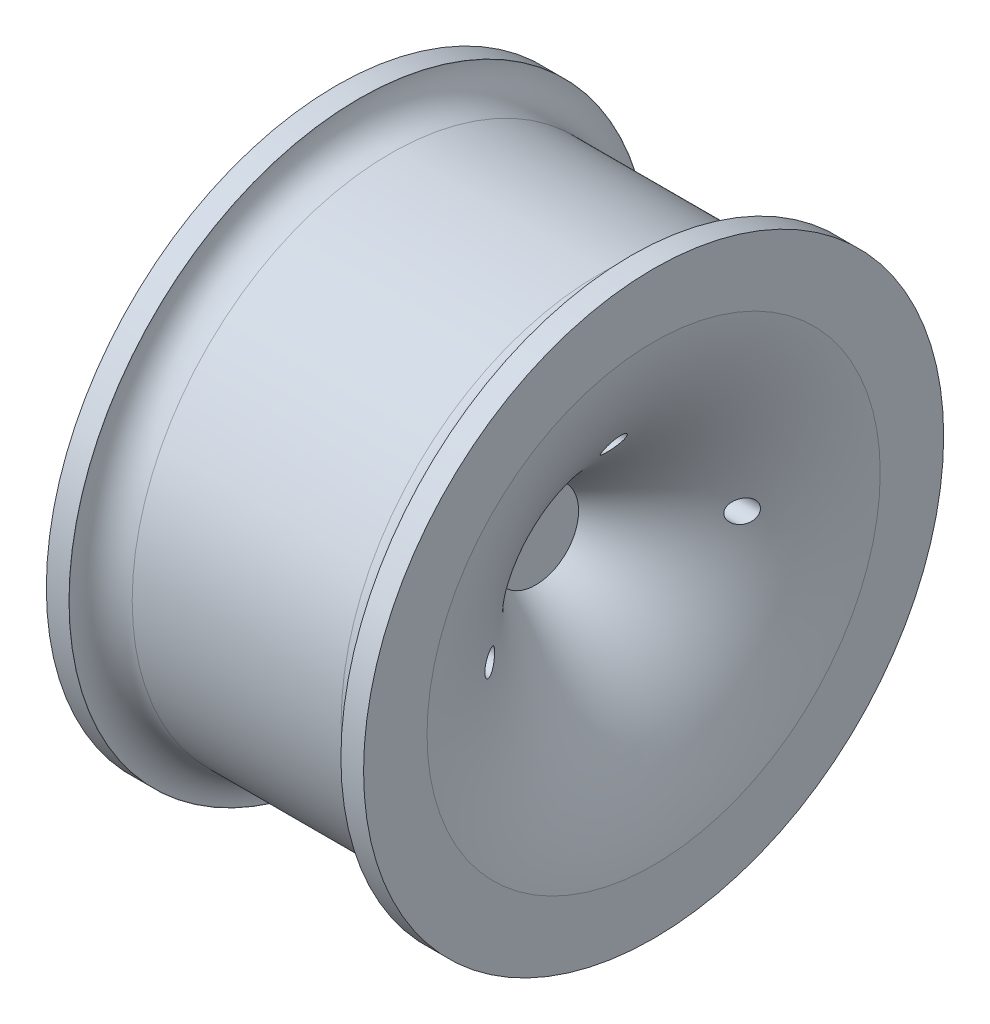
from build123d import *

# Parameters (mm, degrees)
ESQUISSE2_R             = 10.397646043
ESQUISSE2_R_2           = 5
BOSS_EXTRU_1_DEPTH      = 44
ESQUISSE3_R             = 9.441003055
BOSS_EXTRU_2_DEPTH      = 10
ESQUISSE4_R             = 2.5
ENL_V_MAT_EXTRU_1_DEPTH = 111


with BuildPart() as part:
    # Esquisse1 → Révolution1 (revolve)
    with BuildSketch(Plane.XY, mode=Mode.PRIVATE) as r_volution1_sk:
        with BuildLine():
            Line((-35, 50), (-30, 50))
            Line((-30, 50), (29.961005428, 50))
            ThreePointArc((29.961005428, 50), (20.217405473, 26.236864796), (0, 10.397646043))
            Line((0, 10.397646043), (0, 5))
            ThreePointArc((0, 5), (23.755589554, 22.634541458), (35, 50))
            Line((35, 50), (35, 50.592048887))
            Line((35, 50.592048887), (35, 64))
            Line((35, 64), (30, 64))
            Line((30, 64), (30, 63.944286902))
            ThreePointArc((30, 63.944286902), (27.966065457, 59.033934543), (23.055713098, 57))
            Line((23.055713098, 57), (9.532038357, 57))
            Line((9.532038357, 57), (-9.532038357, 57))
            Line((-9.532038357, 57), (-23.055713098, 57))
            ThreePointArc((-23.055713098, 57), (-27.966065457, 59.033934543), (-30, 63.944286902))
            Line((-30, 63.944286902), (-30, 64))
            Line((-30, 64), (-35, 64))
            Line((-35, 64), (-35, 50.592048887))
            Line((-35, 50.592048887), (-35, 50))
        make_face()
    revolve(r_volution1_sk.sketch.rotate(Axis((0, 0, 0), (1, 0, 0)), 90), axis=Axis((0, 0, 0), (1, 0, 0)))

    # Esquisse2 → Boss.-Extru.1 (add)
    with BuildSketch(Plane.ZY.offset(35)):
        Circle(ESQUISSE2_R)
        Circle(ESQUISSE2_R_2, mode=Mode.SUBTRACT)
    extrude(amount=-BOSS_EXTRU_1_DEPTH)

    # Esquisse3 → Boss.-Extru.2 (add)
    with BuildSketch(Plane(origin=(9, 0, 0), x_dir=(0, 0, -1), z_dir=(1, 0, 0))):
        Circle(ESQUISSE3_R)
    extrude(amount=-BOSS_EXTRU_2_DEPTH)

    # Esquisse4 → Enlèv. mat.-Extru.1 (cut)
    with BuildSketch(Plane(origin=(35, 0, 0), x_dir=(0, 0, -1), z_dir=(1, 0, 0))):
        with Locations(Location((0, 26.02006747, 0), (0, 0, 309.751623476))):
            Circle(ESQUISSE4_R)
        with Locations(Location((27.487866147, 0, 0), (0, 0, 289.434771235))):
            Circle(ESQUISSE4_R)
        with Locations(Location((-29.26701606, 0, 0), (0, 0, 359.999999748))):
            Circle(ESQUISSE4_R)
    extrude(amount=-ENL_V_MAT_EXTRU_1_DEPTH, mode=Mode.SUBTRACT)


solid = part.part
